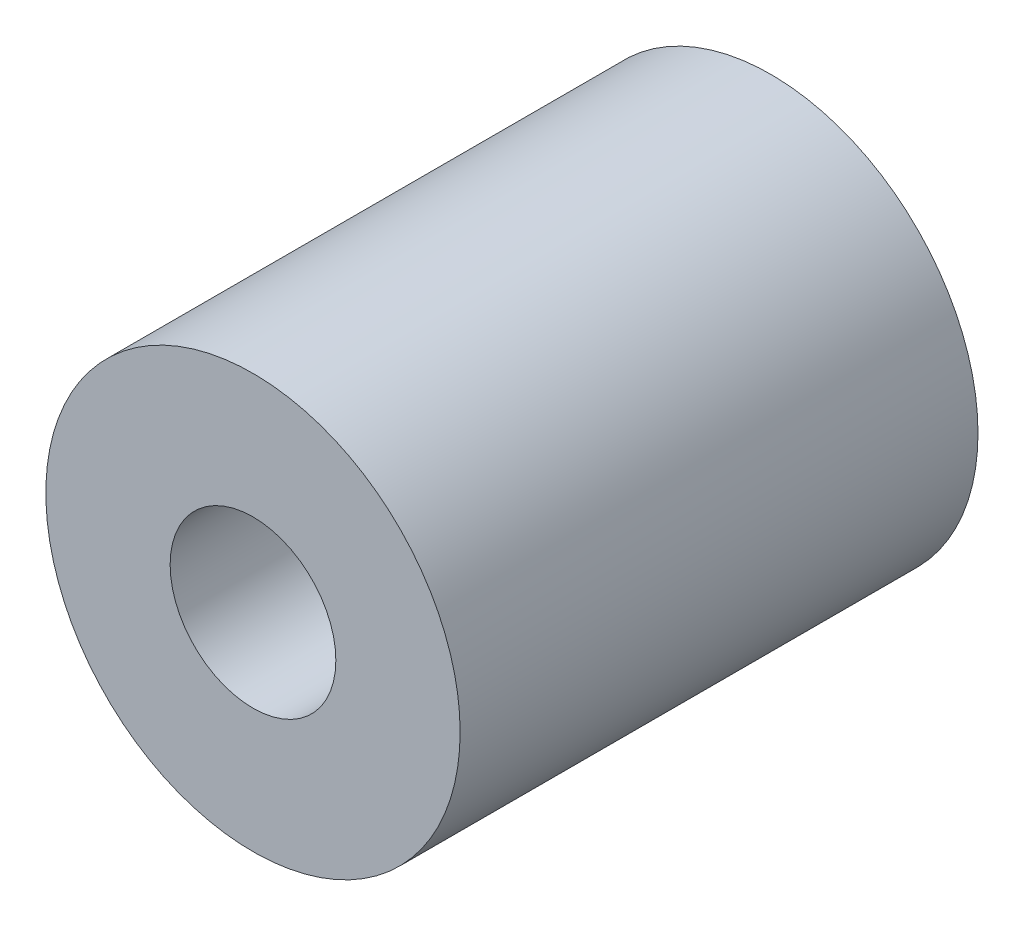
from build123d import *

# Parameters (mm, degrees)
SIX_BORE_START   = 7.5
PROFILE_1_R      = 10
PROFILE_1_R_2    = 3
SIX_BORE_DEPTH   = 12.5
EIGHT_BORE_START = 20
PROFILE_2_R      = 10
PROFILE_2_R_2    = 4
EIGHT_BORE_DEPTH = 12.5


with BuildPart() as part:
    # Profile_1 → Six_bore (new body)
    with BuildSketch(Plane.XY.offset(SIX_BORE_START)):
        Circle(PROFILE_1_R)
        Circle(PROFILE_1_R_2, mode=Mode.SUBTRACT)
    extrude(amount=SIX_BORE_DEPTH)

    # Profile_2 → Eight_bore (add)
    with BuildSketch(Plane.XY.offset(EIGHT_BORE_START)):
        Circle(PROFILE_2_R)
        Circle(PROFILE_2_R_2, mode=Mode.SUBTRACT)
    extrude(amount=EIGHT_BORE_DEPTH)


solid = part.part
